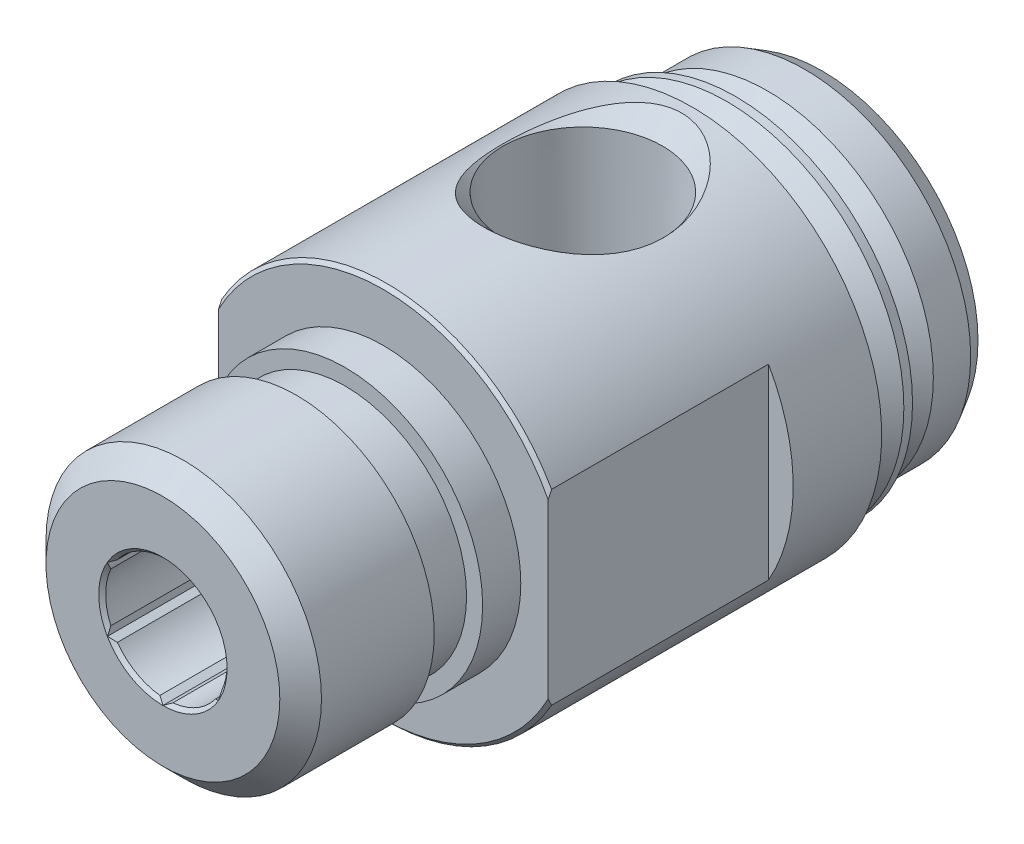
from build123d import *

# Parameters (mm, degrees)
SKETCH1_R               = 9.55
TUBEINTERFACE1_DEPTH    = 5
SKETCH3_R               = 10.922
BODY_DEPTH              = 20.3
BODYCHAMFER_SIZE        = 0.2
SKETCH4_W               = 10
SKETCH4_H               = 75
FLATS_DEPTH             = 12.7
SKETCH5_R               = 7.9375
MOUNTTHREAD1_DEPTH      = 12.7
MOUNTTHREADCHAMFER_SIZE = 1.2
SKETCH17_W              = 2.8
SKETCH17_H              = 5
SKETCH8_R               = 3.5
THRUBORE_DEPTH          = 42.019265815
THRUBORE2_DEPTH         = 38
SKETCH16_R              = 4.639
PORT2_DEPTH             = 10.922
PORT2_DRAFT             = -2
SKETCH26_W              = 2.2
SKETCH26_H              = 0.0127


with BuildPart() as part:
    # Sketch1 → TubeInterface1 (new body)
    with BuildSketch(Plane.XY):
        Circle(SKETCH1_R)
    extrude(amount=TUBEINTERFACE1_DEPTH)

    # Sketch3 → Body (add)
    with BuildSketch(Plane.XY.offset(5)):
        Circle(SKETCH3_R)
    extrude(amount=BODY_DEPTH)

    # BodyChamfer
    bodychamfer_edges = [part.edges().sort_by_distance(p)[0] for p in [
        (-10.922, 0, 25.3),
    ]]
    chamfer(bodychamfer_edges, length=BODYCHAMFER_SIZE)

    # Sketch4 → Flats (cut)
    with BuildSketch(Plane.XY.offset(25.3)):
        with Locations((-14.5, 0)):
            Rectangle(SKETCH4_W, SKETCH4_H)
        with Locations((14.5, 0)):
            Rectangle(SKETCH4_W, SKETCH4_H)
    extrude(amount=-FLATS_DEPTH, mode=Mode.SUBTRACT)

    # Sketch5 → MountThread1 (add)
    with BuildSketch(Plane.XY.offset(25.3)):
        Circle(SKETCH5_R)
    extrude(amount=MOUNTTHREAD1_DEPTH)

    # MountThreadChamfer
    mountthreadchamfer_edges = [part.edges().sort_by_distance(p)[0] for p in [
        (-7.9375, 0, 38),
    ]]
    chamfer(mountthreadchamfer_edges, length=MOUNTTHREADCHAMFER_SIZE)

    # Sketch17 → Cut-Revolve1 (revolve, cut)
    with BuildSketch(Plane(origin=(0, 0, 0), x_dir=(0, 0, -1), z_dir=(1, 0, 0)), mode=Mode.PRIVATE) as cut_revolve1_sk:
        with Locations((-28.9, 9.5)):
            Rectangle(SKETCH17_W, SKETCH17_H)
    revolve(cut_revolve1_sk.sketch.rotate(Axis((0, 0, 0), (0, 0, 1)), 119.564121408), axis=Axis((0, 0, 0), (0, 0, 1)), mode=Mode.SUBTRACT)

    # Sketch8 → ThruBore (cut, through all)
    with BuildSketch(Plane.XY):
        Circle(SKETCH8_R)
    extrude(amount=THRUBORE_DEPTH, mode=Mode.SUBTRACT)

    # Sketch21 → ThruBore2 (cut)
    with BuildSketch(Plane.XY.offset(38)):
        Polygon((3.2, -1.847520861), (3.2, 1.847520861), (0, 3.695041723), (-3.2, 1.847520861), (-3.2, -1.847520861), (0, -3.695041723), align=None)
    extrude(amount=-THRUBORE2_DEPTH, mode=Mode.SUBTRACT)

    # Sketch25 → Chamfer1 (revolve, cut)
    with BuildSketch(Plane(origin=(0, 0, 0), x_dir=(0, 0, -1), z_dir=(1, 0, 0)), mode=Mode.PRIVATE) as chamfer1_sk:
        Polygon((-38, 3.7), (-36, 1.7), (-38, 1.7), align=None)
        Polygon((-38, -3.7), (-36, -1.7), (-38, -1.7), align=None)
    revolve(chamfer1_sk.sketch.rotate(Axis((0, 0, 23.920180356), (0, 0, -1)), 240.435878592), axis=Axis((0, 0, 23.920180356), (0, 0, -1)), mode=Mode.SUBTRACT)


with BuildPart() as port2_tool:
    # Sketch16 → Port2 (with draft: the straight prism first)
    with BuildSketch(Plane(origin=(0, 10.922, 15.05), x_dir=(1, 0, 0), z_dir=(0, 1, 0))):
        with Locations((0, 1.25)):
            Circle(SKETCH16_R)
    extrude(amount=-PORT2_DEPTH)
    # Port2: the draft: its side faces are tilted about the plane it starts from
    port2_sides = [port2_tool.faces().sort_by_distance(p)[0] for p in [
        (-4.639, 5.461, 13.8),
    ]]
    draft(port2_sides, Plane(origin=(0, 10.922, 15.05), x_dir=(1, 0, 0), z_dir=(0, 1, 0)), PORT2_DRAFT)


with BuildPart() as part_1:
    add(part.part)

    # Port2: cut by port2_tool
    add(port2_tool.part, mode=Mode.SUBTRACT)

    # Sketch22 → PortChamfer (revolve, cut)
    with BuildSketch(Plane(origin=(0, 0, 0), x_dir=(0, 0, -1), z_dir=(1, 0, 0)), mode=Mode.PRIVATE) as portchamfer_sk:
        Polygon((-15.8, 10.922), (-19.5, 10.922), (-15.8, 7.222), align=None)
    revolve(portchamfer_sk.sketch.rotate(Axis((0, 0, 13.8), (0, -1, 0)), 90), axis=Axis((0, 0, 13.8), (0, -1, 0)), mode=Mode.SUBTRACT)

    # Sketch23 → RodCoverCrimp (revolve, cut)
    with BuildSketch(Plane(origin=(0, 0, 0), x_dir=(0, 0, -1), z_dir=(1, 0, 0)), mode=Mode.PRIVATE) as rodcovercrimp_sk:
        Polygon((-7.5, 13.6), (-5, 13.6), (-5, 10.2), (-5.5, 10.2), (-7.1, 8.6), (-7.5, 8.6), align=None)
    revolve(rodcovercrimp_sk.sketch.rotate(Axis((0, 0, 0), (0, 0, -1)), 90), axis=Axis((0, 0, 0), (0, 0, -1)), mode=Mode.SUBTRACT)

    # Sketch24 → TubeInterfaceCrimp (revolve, cut)
    with BuildSketch(Plane(origin=(0, 0, 0), x_dir=(0, 0, -1), z_dir=(1, 0, 0)), mode=Mode.PRIVATE) as tubeinterfacecrimp_sk:
        with BuildLine():
            Line((-5, 14.7), (-5, 8.9))
            ThreePointArc((-5, 8.9), (-4.912132034, 8.687867966), (-4.7, 8.6))
            Line((-4.7, 8.6), (-4.1, 8.6))
            Line((-4.1, 8.6), (-3.15, 9.55))
            Line((-3.15, 9.55), (-1, 9.55))
            Line((-1, 9.55), (0, 8.972649731))
            Line((0, 8.972649731), (0, 14.7))
            Line((0, 14.7), (-5, 14.7))
        make_face()
    revolve(tubeinterfacecrimp_sk.sketch.rotate(Axis((0, 0, 0), (0, 0, -1)), 90), axis=Axis((0, 0, 0), (0, 0, -1)), mode=Mode.SUBTRACT)

    # Sketch26 → Cut-Revolve2 (revolve, cut)
    with BuildSketch(Plane(origin=(0, 0, 0), x_dir=(0, 0, -1), z_dir=(1, 0, 0)), mode=Mode.PRIVATE) as cut_revolve2_sk:
        with Locations((-26.4, 7.93115)):
            Rectangle(SKETCH26_W, SKETCH26_H)
    revolve(cut_revolve2_sk.sketch.rotate(Axis((0, 0, 38), (0, 0, 1)), 90), axis=Axis((0, 0, 38), (0, 0, 1)), mode=Mode.SUBTRACT)


solid = part_1.part
